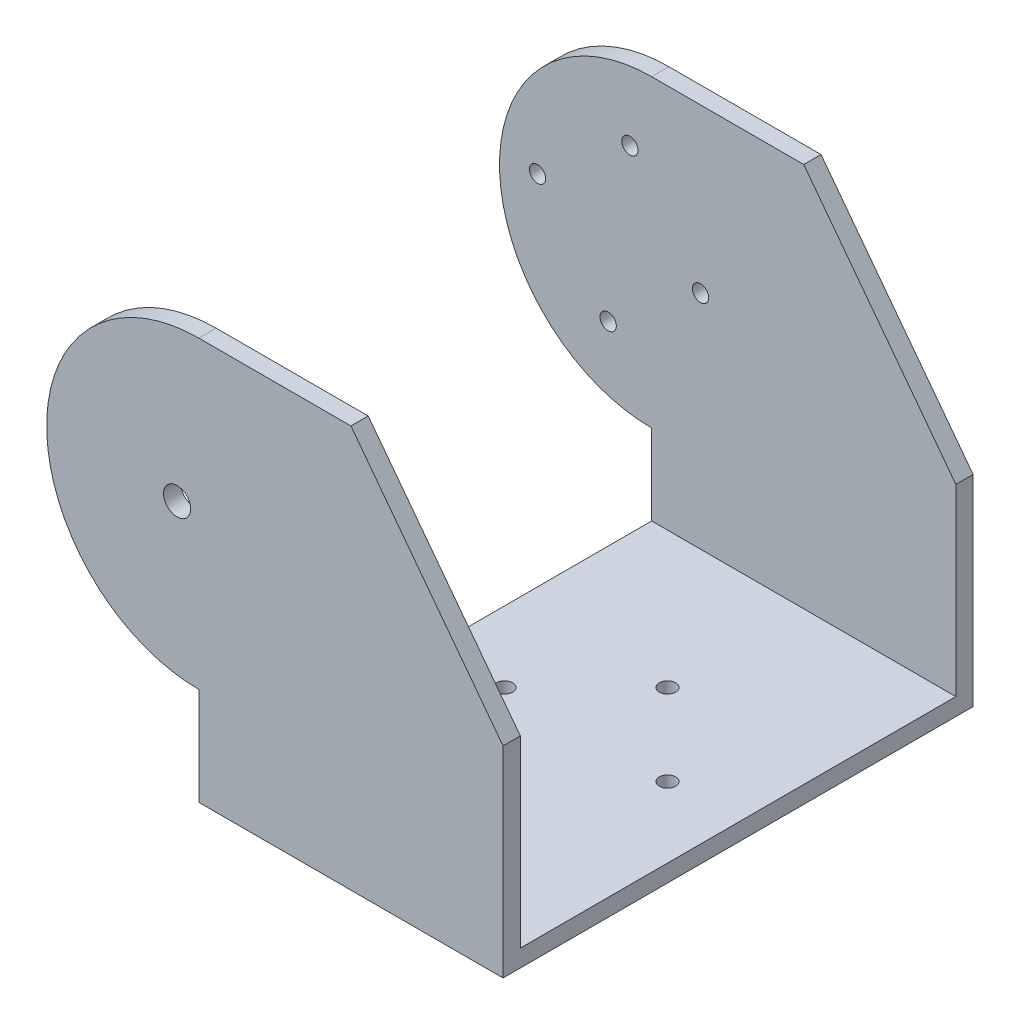
from build123d import *

# Parameters (mm, degrees)
SKETCH1_W           = 28
SKETCH1_H           = 43.264
SKETCH1_R           = 0.75
BOSS_EXTRUDE1_DEPTH = 1.59
SKETCH2_W           = 28
SKETCH2_H           = 1.59
BOSS_EXTRUDE2_DEPTH = 35.41
BOSS_EXTRUDE5_DEPTH = 1.59
BOSS_EXTRUDE6_START = -1.59
BOSS_EXTRUDE6_DEPTH = 1.59
SKETCH9_R           = 0.75
CUT_EXTRUDE3_DEPTH  = 10
SKETCH10_R          = 1.25
CUT_EXTRUDE4_DEPTH  = 10
CUT_EXTRUDE5_REACH  = 65.441


with BuildPart() as part:
    # Sketch1 → Boss-Extrude1 (new body)
    with BuildSketch(Plane(origin=(0, 0, 0), x_dir=(1, 0, 0), z_dir=(0, 1, 0))):
        Rectangle(SKETCH1_W, SKETCH1_H)
        with Locations(Location((0, 7.5, 0), (0, 0, 90))):
            Circle(SKETCH1_R, mode=Mode.SUBTRACT)
        with Locations(Location((0, -7.5, 0), (0, 0, 90))):
            Circle(SKETCH1_R, mode=Mode.SUBTRACT)
        with Locations(Location((7.5, 0, 0), (0, 0, 90))):
            Circle(SKETCH1_R, mode=Mode.SUBTRACT)
        with Locations(Location((-7.5, 0, 0), (0, 0, 90))):
            Circle(SKETCH1_R, mode=Mode.SUBTRACT)
    extrude(amount=BOSS_EXTRUDE1_DEPTH)

    # Sketch2 → Boss-Extrude2 (add)
    with BuildSketch(Plane(origin=(0, 1.59, 0), x_dir=(1, 0, 0), z_dir=(0, 1, 0))):
        with Locations((0, 20.837)):
            Rectangle(SKETCH2_W, SKETCH2_H)
        with Locations((0, -20.837)):
            Rectangle(SKETCH2_W, SKETCH2_H)
    extrude(amount=BOSS_EXTRUDE2_DEPTH)

    # Sketch7 → Boss-Extrude5 (add)
    with BuildSketch(Plane(origin=(0, 0, -21.632), x_dir=(-1, 0, 0), z_dir=(0, 0, -1))):
        with BuildLine():
            Line((14, 37), (14, 9))
            ThreePointArc((14, 9), (28, 23), (14, 37))
        make_face()
    extrude(amount=-BOSS_EXTRUDE5_DEPTH)

    # Sketch8 → Boss-Extrude6 (add)
    with BuildSketch(Plane.XY.offset(21.632).offset(BOSS_EXTRUDE6_START)):
        with BuildLine():
            Line((-14, 37), (-14, 9))
            ThreePointArc((-14, 9), (-28, 23), (-14, 37))
        make_face()
    extrude(amount=BOSS_EXTRUDE6_DEPTH)

    # Sketch9 → Cut-Extrude3 (cut)
    with BuildSketch(Plane(origin=(0, 0, -21.632), x_dir=(-1, 0, 0), z_dir=(0, 0, -1))):
        with Locations((16, 30.5)):
            Circle(SKETCH9_R)
        with Locations((24.5, 24)):
            Circle(SKETCH9_R)
        with Locations((18, 15.5)):
            Circle(SKETCH9_R)
        with Locations((9.5, 22)):
            Circle(SKETCH9_R)
    extrude(amount=-CUT_EXTRUDE3_DEPTH, mode=Mode.SUBTRACT)

    # Sketch10 → Cut-Extrude4 (cut)
    with BuildSketch(Plane.XY.offset(21.632)):
        with Locations((-16, 23)):
            Circle(SKETCH10_R)
    extrude(amount=-CUT_EXTRUDE4_DEPTH, mode=Mode.SUBTRACT)

    # Cut-Extrude5: up to this face of the body (flat: up to its plane)
    cut_extrude5_end = Plane(part.part.faces().sort_by_distance((-4.502841696, 19.512586882, -21.632))[0])
    # Sketch11 → Cut-Extrude5 (cut, up to the picked face)
    with BuildSketch(Plane.XY.offset(21.632), mode=Mode.PRIVATE) as cut_extrude5_sk1:
        Polygon((0, 37), (14, 18.5), (14, 37), align=None)
    cut_extrude5_tool1 = split(extrude(cut_extrude5_sk1.sketch, amount=-CUT_EXTRUDE5_REACH, mode=Mode.PRIVATE), bisect_by=cut_extrude5_end, keep=Keep.BOTH, mode=Mode.PRIVATE)
    add(cut_extrude5_tool1.solids().sort_by(Axis((9.333333, 30.833333, 21.632), (0, 0, -1)))[0], mode=Mode.SUBTRACT)


solid = part.part
